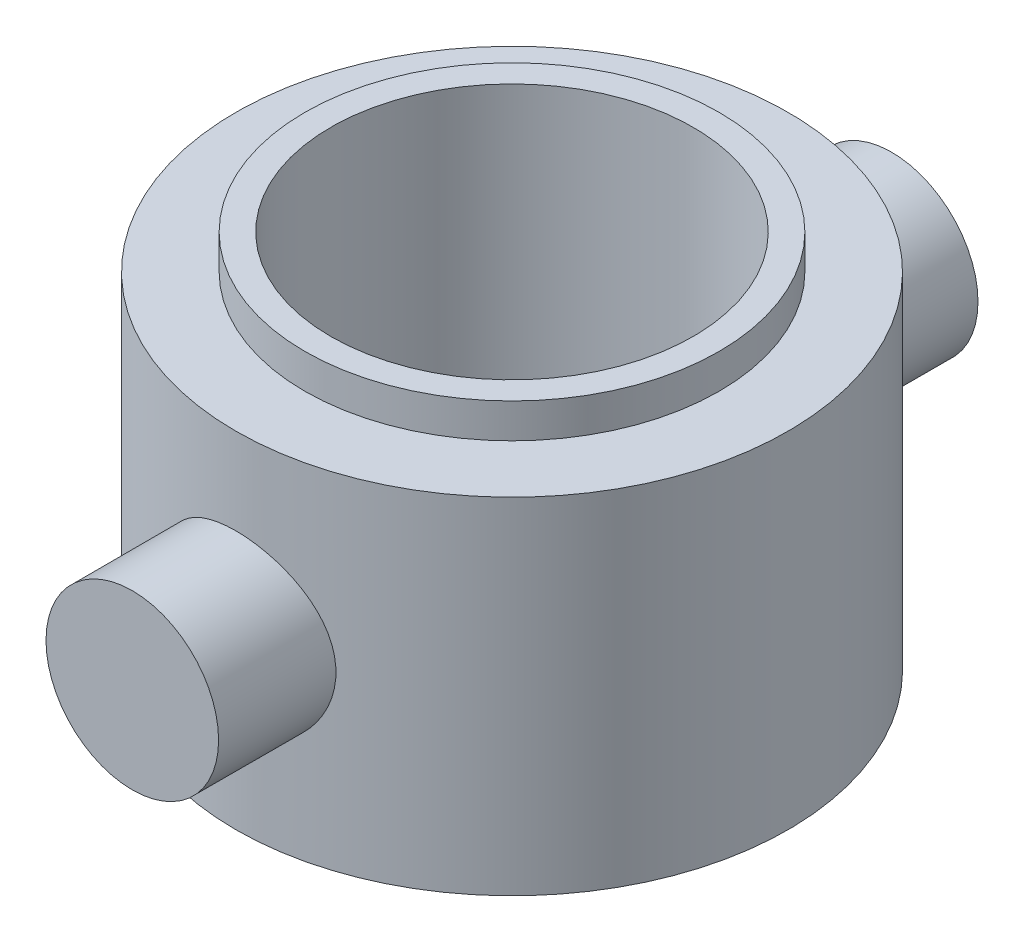
from build123d import *

# Parameters (mm, degrees)
SKETCH1_R           = 8
SKETCH1_R_2         = 5.25
BOSS_EXTRUDE1_DEPTH = 5
SKETCH2_R           = 6
SKETCH2_R_2         = 5.25
BOSS_EXTRUDE2_DEPTH = 1
SKETCH3_R           = 2.5
BOSS_EXTRUDE3_DEPTH = 5


with BuildPart() as part:
    # Sketch1 → Boss-Extrude1 (new, symmetric)
    with BuildSketch(Plane(origin=(0, 0, 0), x_dir=(1, 0, 0), z_dir=(0, 1, 0))):
        with Locations(Location((0, 0, 0), (0, 0, 270))):
            Circle(SKETCH1_R)
        with Locations(Location((0, 0, 0), (0, 0, 270))):
            Circle(SKETCH1_R_2, mode=Mode.SUBTRACT)
    extrude(amount=BOSS_EXTRUDE1_DEPTH, both=True)

    # Sketch2 → Boss-Extrude2 (add, symmetric)
    with BuildSketch(Plane(origin=(0, 5, 0), x_dir=(1, 0, 0), z_dir=(0, 1, 0))):
        with Locations(Location((0, 0, 0), (0, 0, 270))):
            Circle(SKETCH2_R)
        with Locations(Location((0, 0, 0), (0, 0, 270))):
            Circle(SKETCH2_R_2, mode=Mode.SUBTRACT)
    extrude(amount=BOSS_EXTRUDE2_DEPTH, both=True)

    # Sketch3 → Boss-Extrude3 (add)
    with BuildSketch(Plane.XY.offset(6)):
        with Locations(Location((0, 0, 0), (0, 0, 180))):
            Circle(SKETCH3_R)
    boss_extrude3 = extrude(amount=BOSS_EXTRUDE3_DEPTH)

    # Mirror1: Boss-Extrude3 across plane
    add(boss_extrude3.mirror(Plane.XY))


solid = part.part
